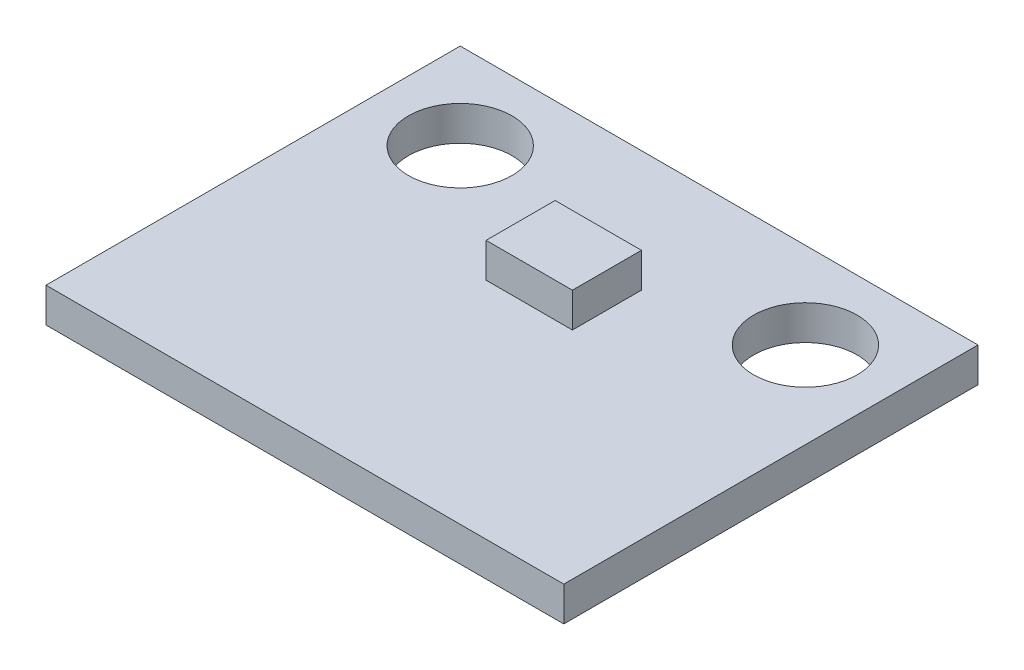
from build123d import *

# Parameters (mm, degrees)
SKETCH1_W    = 15
SKETCH1_H    = 12
SKETCH1_R    = 1.5
PCB_DEPTH    = 1
SKETCH2_W    = 2.5
SKETCH2_H    = 2
SENSOR_DEPTH = 1


with BuildPart() as part:
    # Sketch1 → PCB (new body)
    with BuildSketch(Plane(origin=(0, 0, 0), x_dir=(1, 0, 0), z_dir=(0, 1, 0))):
        Rectangle(SKETCH1_W, SKETCH1_H)
        with Locations(Location((-5, 3.5, 0), (0, 0, 270))):
            Circle(SKETCH1_R, mode=Mode.SUBTRACT)
        with Locations(Location((5, 3.5, 0), (0, 0, 270))):
            Circle(SKETCH1_R, mode=Mode.SUBTRACT)
    extrude(amount=PCB_DEPTH)

    # Sketch2 → Sensor (add)
    with BuildSketch(Plane(origin=(0, 1, 0), x_dir=(1, 0, 0), z_dir=(0, 1, 0))):
        with Locations((0, 1.5)):
            Rectangle(SKETCH2_W, SKETCH2_H)
    extrude(amount=SENSOR_DEPTH)


solid = part.part
